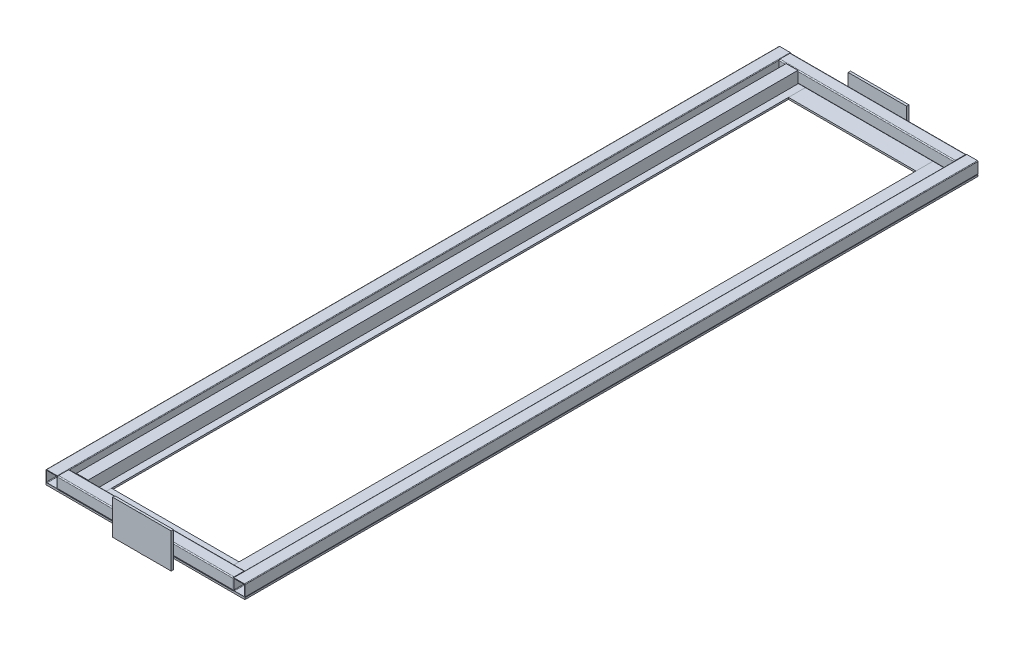
from build123d import *

# Parameters (mm, degrees)
EXTRUDE_1_DEPTH          = 6265.6
PATTERN_LINEAR_1_COUNT   = 2
PATTERN_LINEAR_1_PITCH   = 1600
EXTRUDE_2_DEPTH          = 1500
PATTERN_LINEAR_2_COUNT   = 2
PATTERN_LINEAR_2_PITCH   = 6165.6
SKETCH_4_R               = 150
EXTRUDE_4_DEPTH          = 20
SKETCH_5_R               = 150
EXTRUDE_5_DEPTH          = 20
SKETCH_6_R               = 140
CUT_EXTRUDE_1_DEPTH      = 3
SKETCH_7_R               = 90
CUT_EXTRUDE_2_DEPTH      = 5
SKETCH_8_R               = 6.25
CUT_EXTRUDE_3_DEPTH      = 6520.631228835
PATTERN_CIRCULAR_1_COUNT = 8
SKETCH_21_W              = 500
SKETCH_21_H              = 300
EXTRUDE_11_DEPTH         = 20
SKETCH_22_W              = 500
SKETCH_22_H              = 297.012128168
EXTRUDE_13_DEPTH         = 20
SKETCH_24_W              = 290
SKETCH_24_H              = 6265.6
EXTRUDE_16_DEPTH         = 15
SKETCH_27_W              = 1090
SKETCH_27_H              = 240
EXTRUDE_18_DEPTH         = 15
EXTRUDE_18_2_DEPTH       = 15
SKETCH_28_W              = 100
SKETCH_28_H              = 100
EXTRUDE_19_DEPTH         = 6065.6
SKETCH_29_W              = 320
SKETCH_29_H              = 6265.6
EXTRUDE_21_DEPTH         = 15


with BuildPart() as part:
    # 草图1 → 凸台-拉伸1 (new body)
    with BuildSketch(Plane.XY):
        with BuildLine():
            Line((-45, 50), (45, 50))
            ThreePointArc((45, 50), (48.535533906, 48.535533906), (50, 45))
            Line((50, 45), (50, -45))
            ThreePointArc((50, -45), (48.535533906, -48.535533906), (45, -50))
            Line((45, -50), (-45, -50))
            ThreePointArc((-45, -50), (-48.535533906, -48.535533906), (-50, -45))
            Line((-50, -45), (-50, 45))
            ThreePointArc((-50, 45), (-48.535533906, 48.535533906), (-45, 50))
        make_face()
        with BuildLine():
            Line((-40, 45), (40, 45))
            ThreePointArc((40, 45), (43.535533906, 43.535533906), (45, 40))
            Line((45, 40), (45, -40))
            ThreePointArc((45, -40), (43.535533906, -43.535533906), (40, -45))
            Line((40, -45), (-40, -45))
            ThreePointArc((-40, -45), (-43.535533906, -43.535533906), (-45, -40))
            Line((-45, -40), (-45, 40))
            ThreePointArc((-45, 40), (-43.535533906, 43.535533906), (-40, 45))
        make_face(mode=Mode.SUBTRACT)
    extrude(amount=EXTRUDE_1_DEPTH)


with BuildPart() as pattern_linear_1_1:
    # 阵列(线性)1: pattern copy
    add(part.part.moved(Location(Vector(1, 0, 0) * (1 * PATTERN_LINEAR_1_PITCH))))


with BuildPart() as body_3:
    # 草图2 → 凸台-拉伸2 (new body)
    with BuildSketch(Plane(origin=(50, 0, 0), x_dir=(0, 0, -1), z_dir=(1, 0, 0))):
        with BuildLine():
            Line((-6173.6, -50), (-6257.6, -50))
            ThreePointArc((-6257.6, -50), (-6263.256854249, -47.656854249), (-6265.6, -42))
            Line((-6265.6, -42), (-6265.6, 42))
            ThreePointArc((-6265.6, 42), (-6263.256854249, 47.656854249), (-6257.6, 50))
            Line((-6257.6, 50), (-6173.6, 50))
            ThreePointArc((-6173.6, 50), (-6167.943145751, 47.656854249), (-6165.6, 42))
            Line((-6165.6, 42), (-6165.6, -42))
            ThreePointArc((-6165.6, -42), (-6167.943145751, -47.656854249), (-6173.6, -50))
        make_face()
        with BuildLine():
            Line((-6175.6, 45), (-6255.6, 45))
            ThreePointArc((-6255.6, 45), (-6259.135533906, 43.535533906), (-6260.6, 40))
            Line((-6260.6, 40), (-6260.6, -40))
            ThreePointArc((-6260.6, -40), (-6259.135533906, -43.535533906), (-6255.6, -45))
            Line((-6255.6, -45), (-6175.6, -45))
            ThreePointArc((-6175.6, -45), (-6172.064466094, -43.535533906), (-6170.6, -40))
            Line((-6170.6, -40), (-6170.6, 40))
            ThreePointArc((-6170.6, 40), (-6172.064466094, 43.535533906), (-6175.6, 45))
        make_face(mode=Mode.SUBTRACT)
    extrude(amount=EXTRUDE_2_DEPTH)


with BuildPart() as pattern_linear_2_1:
    # 阵列(线性)2: pattern copy
    add(body_3.part.moved(Location(Vector(0, 0, -1) * (1 * PATTERN_LINEAR_2_PITCH))))



with BuildPart() as body_5:
    # 草图4 → 凸台-拉伸4 (new body)
    with BuildSketch(Plane(origin=(0, 0, 0), x_dir=(-1, 0, 0), z_dir=(0, 0, -1))):
        with Locations((-790, 0)):
            Circle(SKETCH_4_R)
    extrude(amount=EXTRUDE_4_DEPTH)

    # 草图7 → 切除-拉伸2 (cut)
    with BuildSketch(Plane(origin=(0, 0, -20), x_dir=(-1, 0, 0), z_dir=(0, 0, -1))):
        with Locations((-790, 0)):
            Circle(SKETCH_7_R)
    extrude(amount=-CUT_EXTRUDE_2_DEPTH, mode=Mode.SUBTRACT)


with BuildPart() as body_6:
    # 草图5 → 凸台-拉伸5 (new body)
    with BuildSketch(Plane.XY.offset(6265.6)):
        with Locations((790, 0)):
            Circle(SKETCH_5_R)
    extrude(amount=EXTRUDE_5_DEPTH)

    # 草图6 → 切除-拉伸1 (cut)
    with BuildSketch(Plane.XY.offset(6285.6)):
        with Locations((790, 0)):
            Circle(SKETCH_6_R)
    extrude(amount=-CUT_EXTRUDE_1_DEPTH, mode=Mode.SUBTRACT)


with BuildPart() as cut_extrude_3_tool:
    # 草图8 → 切除-拉伸3 (new, through all)
    with BuildSketch(Plane(origin=(0, 0, -20), x_dir=(-1, 0, 0), z_dir=(0, 0, -1))):
        with Locations(Location((-790, 127.5, 0), (0, 0, 180))):
            Circle(SKETCH_8_R)
    cut_extrude_3 = extrude(amount=-CUT_EXTRUDE_3_DEPTH)


with BuildPart() as body_5_1:
    add(body_5.part)

    # 切除-拉伸3: cut by cut_extrude_3_tool
    add(cut_extrude_3_tool.part, mode=Mode.SUBTRACT)


with BuildPart() as body_6_1:
    add(body_6.part)

    # 切除-拉伸3: cut by cut_extrude_3_tool
    add(cut_extrude_3_tool.part, mode=Mode.SUBTRACT)


with BuildPart() as pattern_circular_1_tool:
    # 阵列(圆周)1: 切除-拉伸3 ×8 about axis
    pattern_circular_1_axis = Axis((790, 0, 0), (0, 0, 1))
    for i in range(1, PATTERN_CIRCULAR_1_COUNT):
        add(cut_extrude_3.rotate(pattern_circular_1_axis, i * 360 / PATTERN_CIRCULAR_1_COUNT))


with BuildPart() as body_6_2:
    add(body_6_1.part)

    # 阵列(圆周)1: cut by pattern_circular_1_tool
    add(pattern_circular_1_tool.part, mode=Mode.SUBTRACT)


with BuildPart() as body_5_2:
    add(body_5_1.part)

    # 阵列(圆周)1: cut by pattern_circular_1_tool
    add(pattern_circular_1_tool.part, mode=Mode.SUBTRACT)


with BuildPart() as pattern_linear_2_1_1:
    add(pattern_linear_2_1.part)

    add(body_5_2.part)  # 凸台-拉伸11 merges body 5
    # 草图21 → 凸台-拉伸11 (add)
    with BuildSketch(Plane(origin=(0, 0, -20), x_dir=(-1, 0, 0), z_dir=(0, 0, -1))):
        with Locations((-790, 0)):
            Rectangle(SKETCH_21_W, SKETCH_21_H)
    extrude(amount=-EXTRUDE_11_DEPTH)


with BuildPart() as body_3_1:
    add(body_3.part)

    add(body_6_2.part)  # 凸台-拉伸13 merges body 6
    # 草图22 → 凸台-拉伸13 (add)
    with BuildSketch(Plane.XY.offset(6285.6)):
        with Locations((790, 0)):
            Rectangle(SKETCH_22_W, SKETCH_22_H)
    extrude(amount=-EXTRUDE_13_DEPTH)

    add(pattern_linear_2_1_1.part)  # 凸台-拉伸19 merges 阵列(线性)2_1
    # 草图28 → 凸台-拉伸19 (add)
    with BuildSketch(Plane(origin=(0, 0, 6165.6), x_dir=(-1, 0, 0), z_dir=(0, 0, -1))):
        with Locations((-160, 0)):
            Rectangle(SKETCH_28_W, SKETCH_28_H)
    extrude(amount=EXTRUDE_19_DEPTH)


with BuildPart() as body_5_2_1:
    # 草图24 → 凸台-拉伸16 (new body)
    with BuildSketch(Plane(origin=(0, -50, 0), x_dir=(1, 0, 0), z_dir=(0, 1, 0))):
        with Locations((1505, -3132.8)):
            Rectangle(SKETCH_24_W, SKETCH_24_H)
    extrude(amount=-EXTRUDE_16_DEPTH)


with BuildPart() as body_6_2_1:
    # 草图27 → 凸台-拉伸18 (new body)
    with BuildSketch(Plane.XZ.offset(50)):
        with Locations((815, 6145.6)):
            Rectangle(SKETCH_27_W, SKETCH_27_H)
    extrude(amount=EXTRUDE_18_DEPTH)


with BuildPart() as body_7:
    # 草图27 → Extrude 18 2 (new body)
    with BuildSketch(Plane.XZ.offset(50)):
        with Locations((815, 120)):
            Rectangle(SKETCH_27_W, SKETCH_27_H)
    extrude(amount=EXTRUDE_18_2_DEPTH)


with BuildPart() as body_7_2:
    # 草图29 → 凸台-拉伸21 (new body)
    with BuildSketch(Plane.XZ.offset(65)):
        with Locations((110, 3132.8)):
            Rectangle(SKETCH_29_W, SKETCH_29_H)
    extrude(amount=-EXTRUDE_21_DEPTH)


solid = Compound([part.part, pattern_linear_1_1.part, body_3_1.part, body_5_2_1.part, body_6_2_1.part, body_7.part, body_7_2.part])
